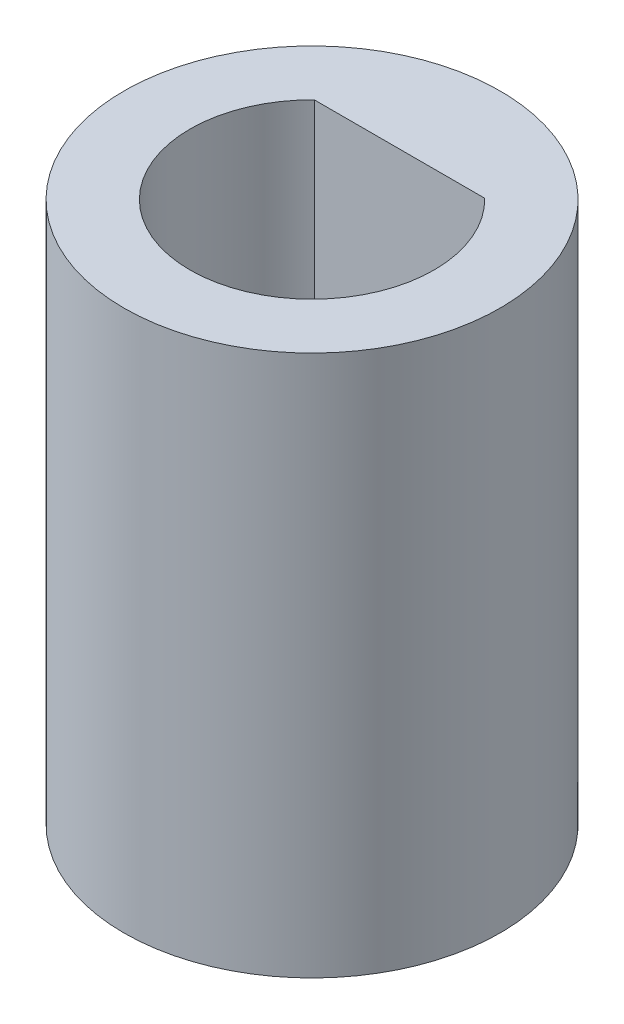
from build123d import *

# Parameters (mm, degrees)
SKETCH1_R           = 5.7
BOSS_EXTRUDE1_DEPTH = 16.4
CUT_EXTRUDE1_DEPTH  = 19.274025282


with BuildPart() as part:
    # Sketch1 → Boss-Extrude1 (new body)
    with BuildSketch(Plane(origin=(0, 0, 0), x_dir=(1, 0, 0), z_dir=(0, 1, 0))):
        with Locations(Location((0, 0, 0), (0, 0, 270))):
            Circle(SKETCH1_R)
    extrude(amount=-BOSS_EXTRUDE1_DEPTH)

    # Sketch3 → Cut-Extrude1 (cut, through all)
    with BuildSketch(Plane(origin=(0, 0, 0), x_dir=(1, 0, 0), z_dir=(0, 1, 0))):
        with BuildLine():
            Line((-2.582150267, 2.65), (2.582150267, 2.65))
            ThreePointArc((2.582150267, 2.65), (0, -3.7), (-2.582150267, 2.65))
        make_face()
    extrude(amount=-CUT_EXTRUDE1_DEPTH, mode=Mode.SUBTRACT)


solid = part.part
